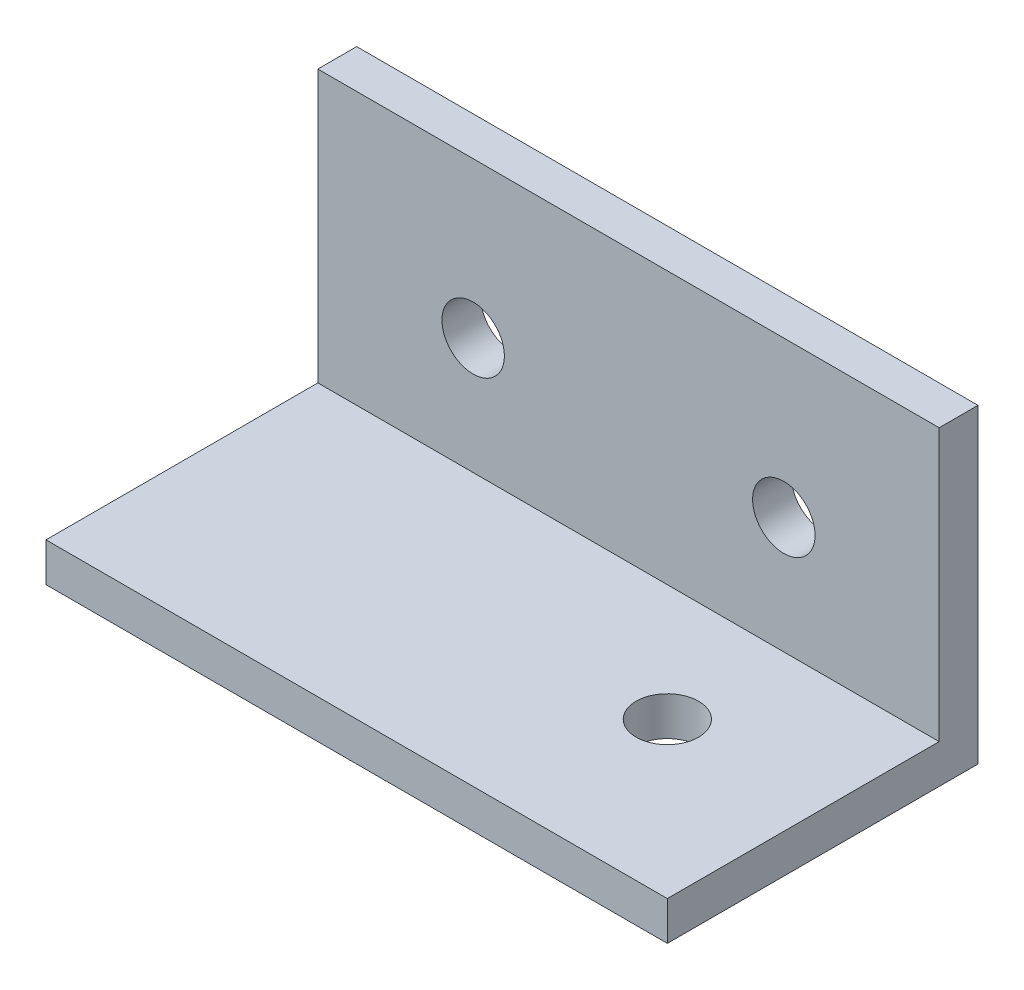
from build123d import *

# Parameters (mm, degrees)
SKETCH1_W                      = 50.8
SKETCH1_H                      = 25.4
BOSS_EXTRUDE1_DEPTH            = 25.4
SKETCH2_W                      = 22.225
SKETCH2_H                      = 22.225
CUT_EXTRUDE1_DEPTH             = 86.194189943
F_7_0_201_DIAMETER_HOLE1_D     = 5.1054
F_7_0_201_DIAMETER_HOLE1_DEPTH = 25.4
F_7_0_201_DIAMETER_HOLE2_D     = 5.1054


with BuildPart() as part:
    # Sketch1 → Boss-Extrude1 (new body)
    with BuildSketch(Plane(origin=(0, 63.5, 0), x_dir=(1, 0, 0), z_dir=(0, 1, 0))):
        with Locations((25.4, -12.7)):
            Rectangle(SKETCH1_W, SKETCH1_H)
    extrude(amount=-BOSS_EXTRUDE1_DEPTH)

    # Sketch2 → Cut-Extrude1 (cut, through all)
    with BuildSketch(Plane(origin=(50.8, 0, 0), x_dir=(0, 0, -1), z_dir=(1, 0, 0))):
        with Locations((-14.2875, 52.3875)):
            Rectangle(SKETCH2_W, SKETCH2_H)
    extrude(amount=-CUT_EXTRUDE1_DEPTH, mode=Mode.SUBTRACT)

    # #7 (0.201) Diameter Hole1
    with Locations(Plane.XZ.offset(-38.1)):
        with Locations((-12.7, -12.7), (38.1, 12.7)):
            Hole(F_7_0_201_DIAMETER_HOLE1_D / 2, depth=F_7_0_201_DIAMETER_HOLE1_DEPTH)

    # #7 (0.201) Diameter Hole2 (through all)
    with Locations(Plane.XY.offset(3.175)):
        with Locations((38.1, 50.8), (12.7, 50.8)):
            Hole(F_7_0_201_DIAMETER_HOLE2_D / 2)


solid = part.part
